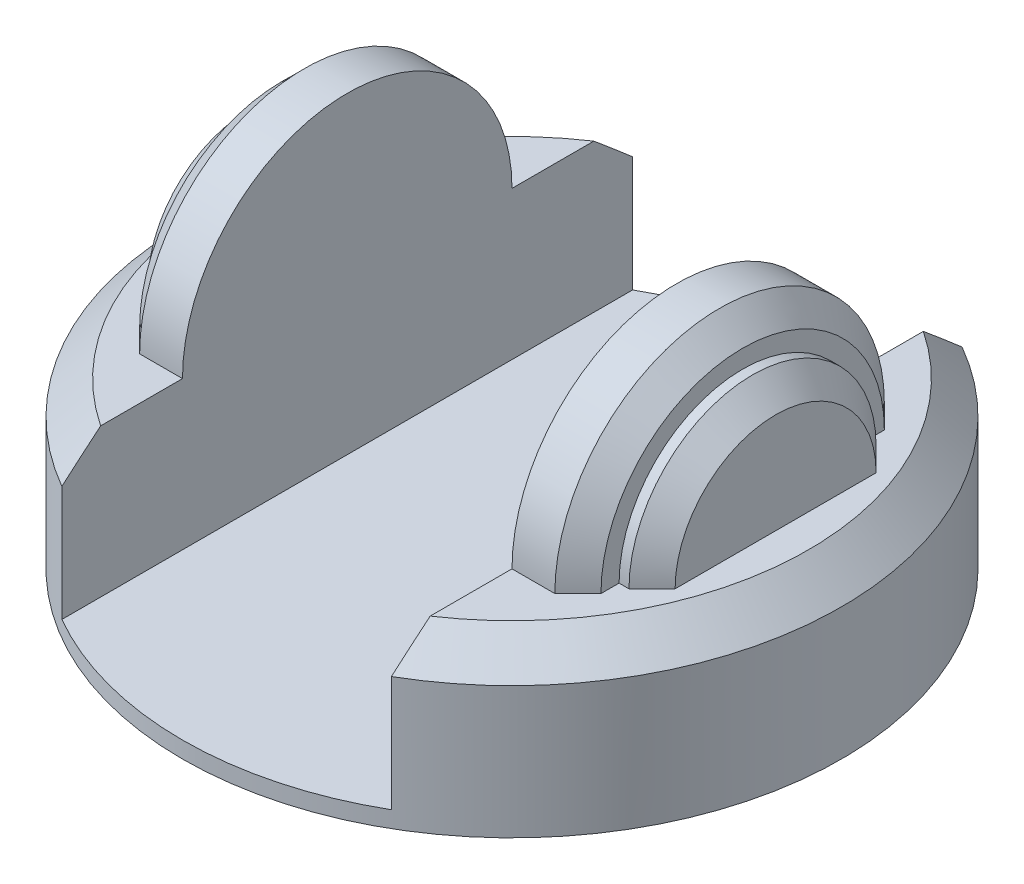
from build123d import *

# Parameters (mm, degrees)
SKETCH1_R           = 100
BOSS_EXTRUDE1_DEPTH = 50
SKETCH2_W           = 100
SKETCH2_H           = 214.27053556
CUT_EXTRUDE1_DEPTH  = 45
SKETCH3_R           = 50
BOSS_EXTRUDE2_DEPTH = 20
SKETCH4_R           = 37.5
BOSS_EXTRUDE3_DEPTH = 10
CHAMFER1_SIZE       = 10
CHAMFER2_SIZE       = 7


with BuildPart() as part:
    # Sketch1 → Boss-Extrude1 (new body)
    with BuildSketch(Plane(origin=(0, 0, 0), x_dir=(1, 0, 0), z_dir=(0, 1, 0))):
        with Locations(Location((0, 0, 0), (0, 0, 270))):
            Circle(SKETCH1_R)
    extrude(amount=BOSS_EXTRUDE1_DEPTH)

    # Sketch2 → Cut-Extrude1 (cut)
    with BuildSketch(Plane(origin=(0, 50, 0), x_dir=(1, 0, 0), z_dir=(0, 1, 0))):
        Rectangle(SKETCH2_W, SKETCH2_H)
    extrude(amount=-CUT_EXTRUDE1_DEPTH, mode=Mode.SUBTRACT)

    # Sketch3 → Boss-Extrude2 (add)
    with BuildSketch(Plane(origin=(-50, 0, 0), x_dir=(0, 0, -1), z_dir=(1, 0, 0))):
        with Locations((0, 50)):
            Circle(SKETCH3_R)
    boss_extrude2 = extrude(amount=-BOSS_EXTRUDE2_DEPTH)

    # Mirror1: Boss-Extrude2 across plane
    add(boss_extrude2.mirror(Plane(origin=(0, 0, 0), x_dir=(0, 0, 1), z_dir=(1, 0, 0))))

    # Sketch4 → Boss-Extrude3 (add)
    with BuildSketch(Plane(origin=(70, 0, 0), x_dir=(0, 0, -1), z_dir=(1, 0, 0))):
        with Locations((0, 50)):
            Circle(SKETCH4_R)
    boss_extrude3 = extrude(amount=BOSS_EXTRUDE3_DEPTH)

    # Mirror2: Boss-Extrude3 across plane
    add(boss_extrude3.mirror(Plane(origin=(0, 0, 0), x_dir=(0, 0, 1), z_dir=(1, 0, 0))))

    # Chamfer1
    chamfer1_edges = [part.edges().sort_by_distance(p)[0] for p in [
        (100, 50, 0),
        (-100, 50, 0),
    ]]
    chamfer(chamfer1_edges, length=CHAMFER1_SIZE)

    # Chamfer2
    chamfer2_edges = [part.edges().sort_by_distance(p)[0] for p in [
        (-70, 100, 0),
        (70, 100, 0),
        (80, 87.5, 0),
        (-80, 87.5, 0),
    ]]
    chamfer(chamfer2_edges, length=CHAMFER2_SIZE)


solid = part.part
